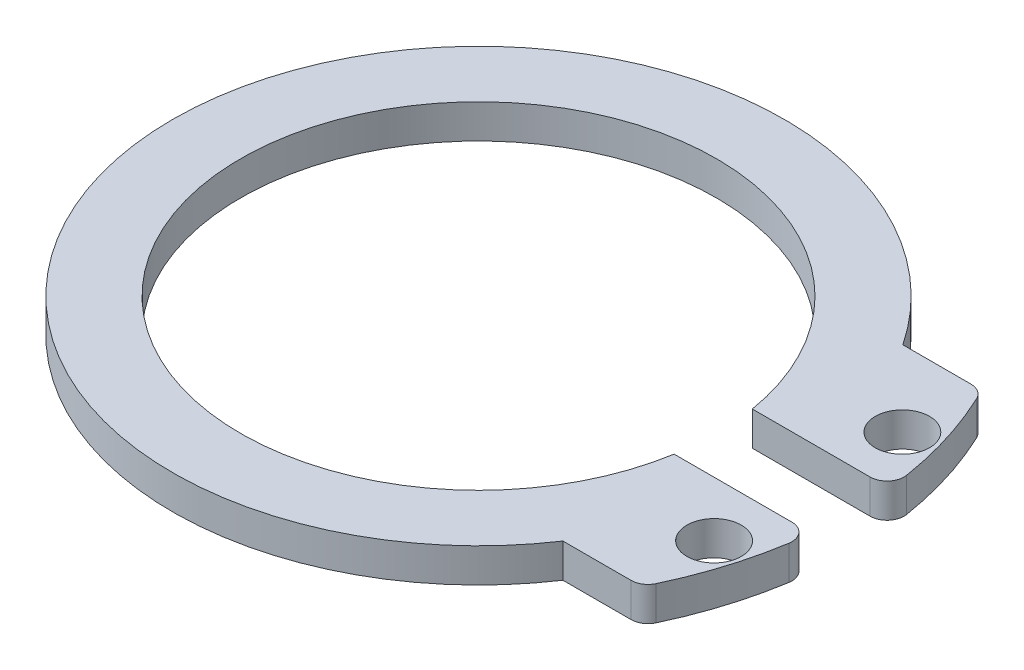
from build123d import *

# Parameters (mm, degrees)
SKETCH_1_R          = 9
SKETCH_1_R_2        = 7
EXTRUDE_1_DEPTH     = 1
EXTRUDE_START       = -1
SKETCH_2_R          = 0.8
EXTRUDE_2_DEPTH     = 1
SKETCH_3_W          = 6.510588585
SKETCH_3_H          = 2.3
CUT_EXTRUDE_1_DEPTH = 15.201320361
FILLET_1_R          = 0.5


with BuildPart() as part:
    # 草图1 → 凸台-拉伸1 (new body)
    with BuildSketch(Plane(origin=(0, 0, 0), x_dir=(1, 0, 0), z_dir=(0, 1, 0))):
        with Locations(Location((0, 0, 0), (0, 0, 270))):
            Circle(SKETCH_1_R)
        with Locations(Location((0, 0, 0), (0, 0, 270))):
            Circle(SKETCH_1_R_2, mode=Mode.SUBTRACT)
    extrude(amount=EXTRUDE_1_DEPTH)

    # 草图2 → 凸台-拉伸2 (add)
    # profile 1 of 2: a face of its own
    with BuildSketch(Plane(origin=(0, 1, 0), x_dir=(1, 0, 0), z_dir=(0, 1, 0)).offset(EXTRUDE_START)):
        with BuildLine():
            Line((10.939721203, 1.15), (8.926225406, 1.15))
            ThreePointArc((8.926225406, 1.15), (8.427566507, 3.158500083), (7.483314774, 5))
            Line((7.483314774, 5), (9.797958971, 5))
            ThreePointArc((9.797958971, 5), (10.546016772, 3.127543804), (10.939721203, 1.15))
        make_face()
        with Locations(Location((9.7, 2.769537095, 0), (0, 0, 270))):
            Circle(SKETCH_2_R, mode=Mode.SUBTRACT)
    # profile 2 of 2: a face of its own
    with BuildSketch(Plane(origin=(0, 1, 0), x_dir=(1, 0, 0), z_dir=(0, 1, 0)).offset(EXTRUDE_START)):
        with BuildLine():
            Line((10.939721203, -1.15), (8.926225406, -1.15))
            ThreePointArc((8.926225406, -1.15), (8.427566507, -3.158500083), (7.483314774, -5))
            Line((7.483314774, -5), (9.797958971, -5))
            ThreePointArc((9.797958971, -5), (10.546016772, -3.127543804), (10.939721203, -1.15))
        make_face()
        with Locations(Location((9.7, -2.769537095, 0), (0, 0, 270))):
            Circle(SKETCH_2_R, mode=Mode.SUBTRACT)
    extrude(amount=EXTRUDE_2_DEPTH)

    # 草图3 → 切除-拉伸1 (cut, through all)
    with BuildSketch(Plane(origin=(0, 1, 0), x_dir=(1, 0, 0), z_dir=(0, 1, 0))):
        with Locations((7.684426911, 0)):
            Rectangle(SKETCH_3_W, SKETCH_3_H)
    extrude(amount=-CUT_EXTRUDE_1_DEPTH, mode=Mode.SUBTRACT)

    # 圆角1
    fillet_1_edges = [part.edges().sort_by_distance(p)[0] for p in [
        (10.939721203, 0.5, -1.15),
        (9.797958971, 0.5, -5),
        (9.797958971, 0.5, 5),
        (10.939721203, 0.5, 1.15),
    ]]
    fillet(fillet_1_edges, radius=FILLET_1_R)


solid = part.part
